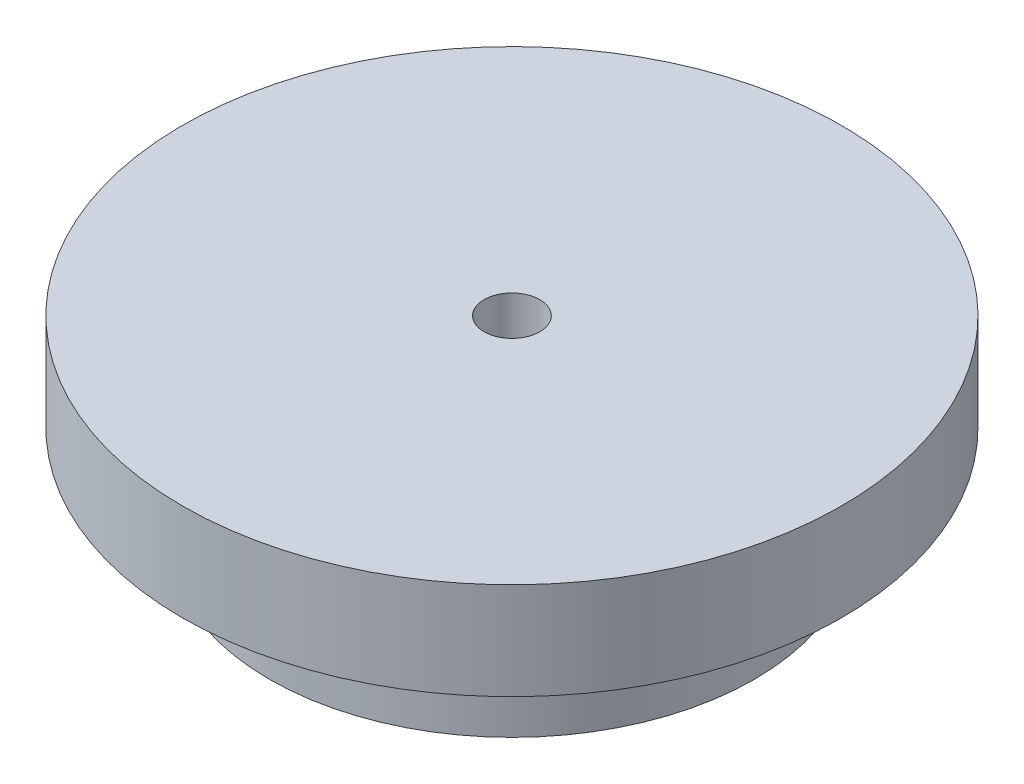
from build123d import *

# Parameters (mm, degrees)
SKETCH1_R           = 25
BOSS_EXTRUDE1_DEPTH = 10
SKETCH2_R           = 34
SKETCH2_R_2         = 2.875
BOSS_EXTRUDE2_DEPTH = 10


with BuildPart() as part:
    # Sketch1 → Boss-Extrude1 (new body)
    with BuildSketch(Plane(origin=(0, 0, 0), x_dir=(1, 0, 0), z_dir=(0, 1, 0))):
        with Locations(Location((0, 0, 0), (0, 0, 270))):
            Circle(SKETCH1_R)
        with BuildLine():
            Line((-1.5, 11), (1.5, 11))
            Line((1.5, 11), (2.425924848, 8.146464793))
            ThreePointArc((2.425924848, 8.146464793), (3.252809175, 7.852976026), (4.045032587, 7.475808409))
            Line((4.045032587, 7.475808409), (6.717514421, 8.838834765))
            Line((6.717514421, 8.838834765), (8.838834765, 6.717514421))
            Line((8.838834765, 6.717514421), (7.475808409, 4.045032587))
            ThreePointArc((7.475808409, 4.045032587), (7.852976026, 3.252809175), (8.146464793, 2.425924848))
            Line((8.146464793, 2.425924848), (11, 1.5))
            Line((11, 1.5), (11, -1.5))
            Line((11, -1.5), (8.146464793, -2.425924848))
            ThreePointArc((8.146464793, -2.425924848), (7.852976026, -3.252809175), (7.475808409, -4.045032587))
            Line((7.475808409, -4.045032587), (8.838834765, -6.717514421))
            Line((8.838834765, -6.717514421), (6.717514421, -8.838834765))
            Line((6.717514421, -8.838834765), (4.045032587, -7.475808409))
            ThreePointArc((4.045032587, -7.475808409), (3.252809175, -7.852976026), (2.425924848, -8.146464793))
            Line((2.425924848, -8.146464793), (1.5, -11))
            Line((1.5, -11), (-1.5, -11))
            Line((-1.5, -11), (-2.425924848, -8.146464793))
            ThreePointArc((-2.425924848, -8.146464793), (-3.252809175, -7.852976026), (-4.045032587, -7.475808409))
            Line((-4.045032587, -7.475808409), (-6.717514421, -8.838834765))
            Line((-6.717514421, -8.838834765), (-8.838834765, -6.717514421))
            Line((-8.838834765, -6.717514421), (-7.475808409, -4.045032587))
            ThreePointArc((-7.475808409, -4.045032587), (-7.852976026, -3.252809175), (-8.146464793, -2.425924848))
            Line((-8.146464793, -2.425924848), (-11, -1.5))
            Line((-11, -1.5), (-11, 1.5))
            Line((-11, 1.5), (-8.146464793, 2.425924848))
            ThreePointArc((-8.146464793, 2.425924848), (-7.852976026, 3.252809175), (-7.475808409, 4.045032587))
            Line((-7.475808409, 4.045032587), (-8.838834765, 6.717514421))
            Line((-8.838834765, 6.717514421), (-6.717514421, 8.838834765))
            Line((-6.717514421, 8.838834765), (-4.045032587, 7.475808409))
            ThreePointArc((-4.045032587, 7.475808409), (-3.252809175, 7.852976026), (-2.425924848, 8.146464793))
            Line((-2.425924848, 8.146464793), (-1.5, 11))
        make_face(mode=Mode.SUBTRACT)
    extrude(amount=BOSS_EXTRUDE1_DEPTH)

    # Sketch2 → Boss-Extrude2 (add)
    with BuildSketch(Plane(origin=(0, 10, 0), x_dir=(1, 0, 0), z_dir=(0, 1, 0))):
        with Locations(Location((0, 0, 0), (0, 0, 270))):
            Circle(SKETCH2_R)
        with Locations(Location((0, 0, 0), (0, 0, 270))):
            Circle(SKETCH2_R_2, mode=Mode.SUBTRACT)
    extrude(amount=BOSS_EXTRUDE2_DEPTH)


solid = part.part
